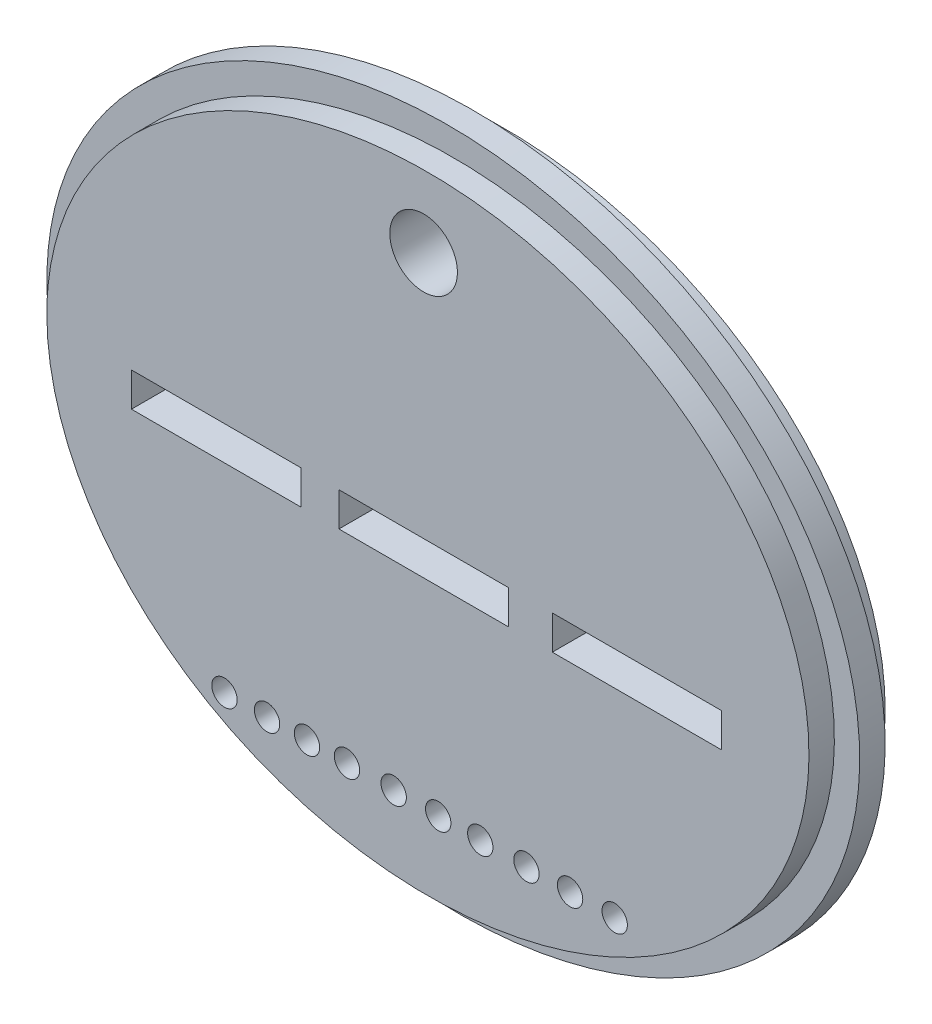
from build123d import *

# Parameters (mm, degrees)
SKETCH1_RX               = 48
SKETCH1_RY               = 40
BOSS_EXTRUDE1_DEPTH      = 3
BOSS_EXTRUDE2_DEPTH      = 3
BOSS_EXTRUDE2_DEPTH_BACK = 6
SKETCH2_RX               = 45
SKETCH2_RY               = 37
SKETCH4_R                = 1.5
SKETCH4_R_2              = 3.992919847
SKETCH4_W                = 20
SKETCH4_H                = 4.015498802
CUT_EXTRUDE1_DEPTH       = 14


with BuildPart() as part:
    # Sketch1 → Boss-Extrude1 (new body)
    with BuildSketch(Plane.XY):
        with Locations(Location((0, 0), (0, 0, 178.024329661))):
            Ellipse(SKETCH1_RX, SKETCH1_RY)
    extrude(amount=BOSS_EXTRUDE1_DEPTH)

    # Sketch2 → Boss-Extrude2 (add, two sides: drawn at the far end of the back side and taken through both)
    with BuildSketch(Plane.XY.offset(3).offset(-BOSS_EXTRUDE2_DEPTH_BACK)):
        with Locations(Location((0, 0), (0, 0, 180))):
            Ellipse(SKETCH2_RX, SKETCH2_RY)
    extrude(amount=BOSS_EXTRUDE2_DEPTH + BOSS_EXTRUDE2_DEPTH_BACK)

    # Sketch4 → Cut-Extrude1 (cut)
    with BuildSketch(Plane.XY.offset(6)):
        with Locations((22.058053454, -28.226221002)):
            Circle(SKETCH4_R)
        with Locations((16.787148935, -28.226221002)):
            Circle(SKETCH4_R)
        with Locations((11.639910332, -28.226221002)):
            Circle(SKETCH4_R)
        with Locations((6.186040487, -28.226221002)):
            Circle(SKETCH4_R)
        with Locations((1.221767211, -28.226221002)):
            Circle(SKETCH4_R)
        with Locations((-4.043788707, -28.226221002)):
            Circle(SKETCH4_R)
        with Locations((-9.558860428, -28.226221002)):
            Circle(SKETCH4_R)
        with Locations((-14.276714459, -28.226221002)):
            Circle(SKETCH4_R)
        with Locations((-18.995344935, -28.226221002)):
            Circle(SKETCH4_R)
        with Locations((-24.023984717, -28.226221002)):
            Circle(SKETCH4_R)
        with Locations((-0.507231803, 28.493006682)):
            Circle(SKETCH4_R_2)
        with Locations((24.692949171, -2.731214522)):
            Rectangle(SKETCH4_W, SKETCH4_H)
        with Locations((-0.507231803, -2.731214522)):
            Rectangle(SKETCH4_W, SKETCH4_H)
        with Locations((-25.007748312, -2.731214522)):
            Rectangle(SKETCH4_W, SKETCH4_H)
    extrude(amount=-CUT_EXTRUDE1_DEPTH, mode=Mode.SUBTRACT)


solid = part.part
